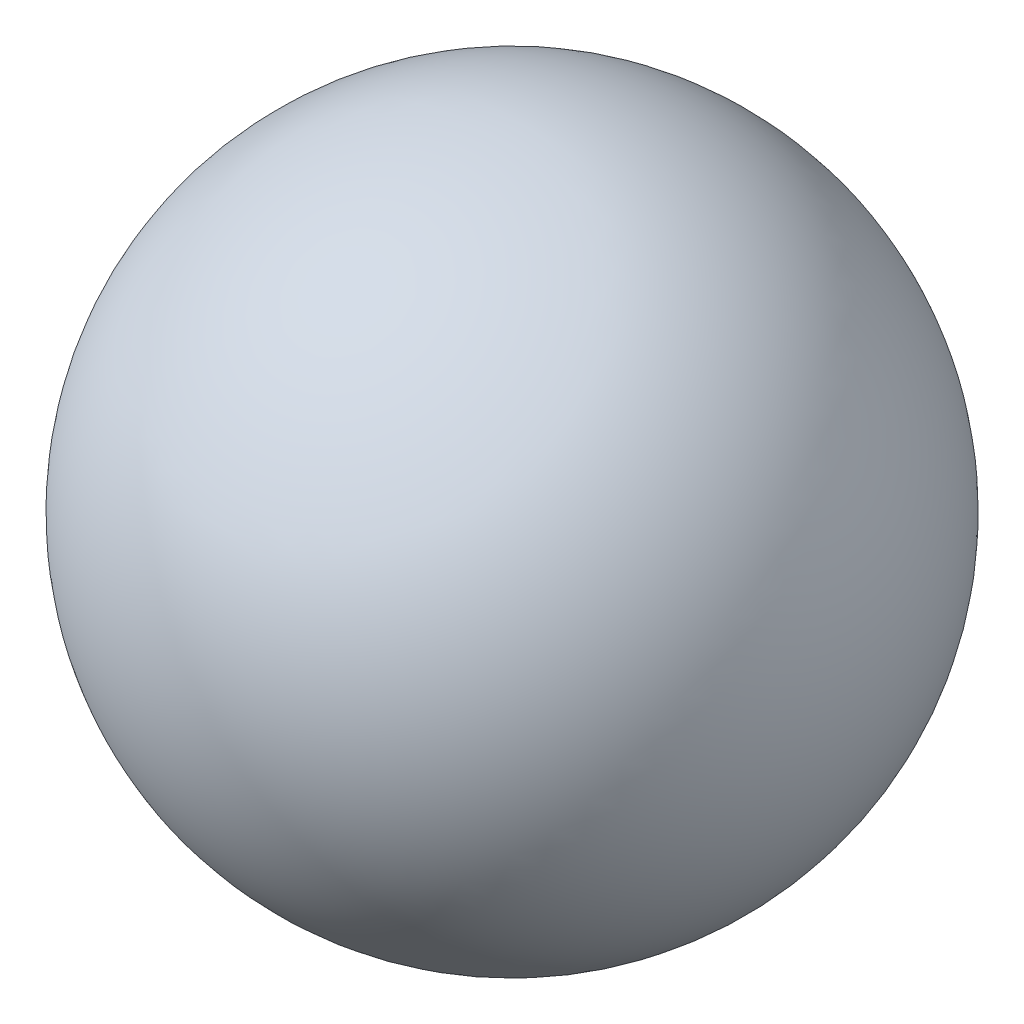
from build123d import *


with BuildPart() as part:
    # Esboço1 → Revolução1 (revolve)
    with BuildSketch(Plane(origin=(0, 0, 0), x_dir=(1, 0, 0), z_dir=(0, 1, 0))):
        with BuildLine():
            Line((0, 0), (0, 50))
            ThreePointArc((0, 50), (-25, 25), (0, 0))
        make_face()
    revolve(axis=Axis((0, 0, 0), (0, 0, -1)))


solid = part.part
